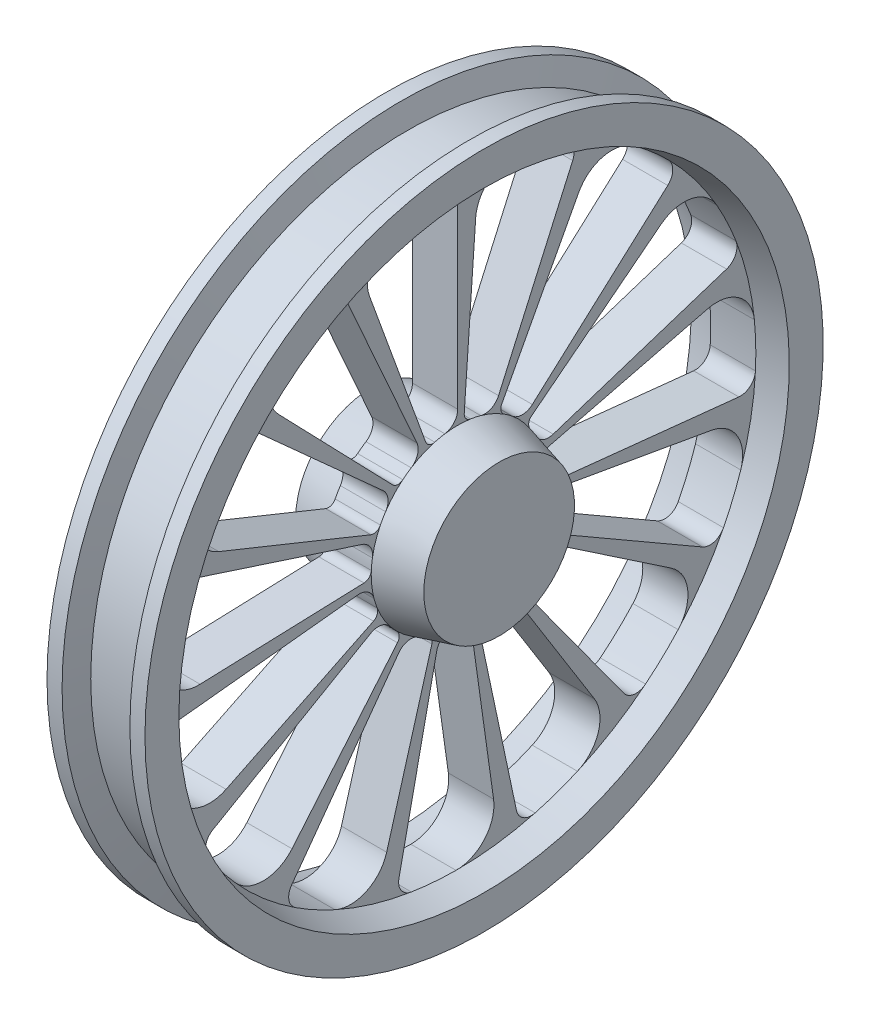
from build123d import *

# Parameters (mm, degrees)
ENL_V_MAT_EXTRU_1_DEPTH = 647.703177663


with BuildPart() as part:
    # Esquisse2 → Révolution1 (revolve)
    with BuildSketch(Plane.XY, mode=Mode.PRIVATE) as r_volution1_sk:
        Polygon((-85, 0), (-85, 100), (-30, 114.737205584), (-30, 395.621778265), (-65, 405), (-65, 450), (-45, 450), (-36.961524227, 420), (36.961524227, 420), (45, 450), (65, 450), (65, 405), (30, 395.621778265), (30, 114.737205584), (85, 100), (85, 0), align=None)
    revolve(r_volution1_sk.sketch.rotate(Axis((-85, 0, 0), (1, 0, 0)), 90), axis=Axis((-85, 0, 0), (1, 0, 0)))

    # Esquisse3 → Enlèv. mat.-Extru.1 (cut, through all)
    with BuildSketch(Plane.ZY.offset(30)):
        with BuildLine():
            Line((0, 375.08894986), (0, 133.24456675))
            ThreePointArc((0, 133.24456675), (4.844558076, 120.194180546), (17.031258009, 113.46612973))
            ThreePointArc((17.031258009, 113.46612973), (23.794589812, 112.242789705), (30.472538424, 110.616683855))
            ThreePointArc((30.472538424, 110.616683855), (37.714753572, 111.371314729), (42.525319659, 116.837355519))
            Line((42.525319659, 116.837355519), (116.966095442, 321.36170607))
            ThreePointArc((116.966095442, 321.36170607), (113.645015457, 362.824451872), (80.105459591, 387.427034138))
            ThreePointArc((80.105459591, 387.427034138), (50.728968231, 392.35591396), (21.064900981, 395.060579385))
            ThreePointArc((21.064900981, 395.060579385), (6.239513446, 389.602702297), (0, 375.08894986))
        make_face()
        with BuildLine():
            Line((152.562420321, 342.660806356), (54.195447788, 121.72496871))
            ThreePointArc((54.195447788, 121.72496871), (53.313101537, 107.832388384), (61.709661101, 96.729230701))
            ThreePointArc((61.709661101, 96.729230701), (67.390694934, 92.860759105), (72.82990772, 88.659071091))
            ThreePointArc((72.82990772, 88.659071091), (79.7529365, 86.40278642), (86.370846379, 89.439629654))
            Line((86.370846379, 89.439629654), (237.563426729, 246.004129826))
            ThreePointArc((237.563426729, 246.004129826), (251.393887235, 285.233037841), (230.760750044, 321.350381479))
            ThreePointArc((230.760750044, 321.350381479), (205.928745834, 337.801632733), (179.929358477, 352.337930679))
            ThreePointArc((179.929358477, 352.337930679), (164.165774432, 353.381940215), (152.562420321, 342.660806356))
        make_face()
        with BuildLine():
            Line((278.745412182, 250.983496458), (99.020010304, 89.158017744))
            ThreePointArc((99.020010304, 89.158017744), (92.563325408, 76.825396644), (95.717903174, 63.266968927))
            ThreePointArc((95.717903174, 63.266968927), (99.334336676, 57.422259641), (102.594324332, 51.371499492))
            ThreePointArc((102.594324332, 51.371499492), (108.001112174, 46.494431395), (115.282069106, 46.576979287))
            Line((115.282069106, 46.576979287), (317.083883339, 128.110204659))
            ThreePointArc((317.083883339, 128.110204659), (345.674472068, 158.322240305), (341.515410419, 199.709328485))
            ThreePointArc((341.515410419, 199.709328485), (325.521572478, 224.838380374), (307.682395286, 248.69285287))
            ThreePointArc((307.682395286, 248.69285287), (293.70628162, 256.058230296), (278.745412182, 250.983496458))
        make_face()
        with BuildLine():
            Line((356.730789954, 115.908859909), (126.723113469, 41.174835534))
            ThreePointArc((126.723113469, 41.174835534), (115.808509405, 32.534595887), (113.175650218, 18.865273462))
            ThreePointArc((113.175650218, 18.865273462), (114.102169183, 12.054929821), (114.619250226, 5.201328936))
            ThreePointArc((114.619250226, 5.201328936), (117.574914394, -1.453233208), (124.259974779, -4.339253936))
            Line((124.259974779, -4.339253936), (341.777655903, -11.935138739))
            ThreePointArc((341.777655903, -11.935138739), (380.184800327, 4.036089109), (393.218953762, 43.536718294))
            ThreePointArc((393.218953762, 43.536718294), (388.82876197, 72.998529456), (382.234350743, 102.046521495))
            ThreePointArc((382.234350743, 102.046521495), (372.462304477, 114.459726143), (356.730789954, 115.908859909))
        make_face()
        with BuildLine():
            Line((373.034173346, -39.207471518), (132.514639072, -13.927849801))
            ThreePointArc((132.514639072, -13.927849801), (119.029350038, -17.381732066), (111.064299172, -28.798399169))
            ThreePointArc((111.064299172, -28.798399169), (109.140700052, -35.39680688), (106.825466474, -41.868198646))
            ThreePointArc((106.825466474, -41.868198646), (106.818945781, -49.149620586), (111.752201947, -54.505190733))
            Line((111.752201947, -54.505190733), (307.374966808, -149.916788222))
            ThreePointArc((307.374966808, -149.916788222), (348.957722738, -150.947938561), (376.931367718, -120.163786009))
            ThreePointArc((376.931367718, -120.163786009), (384.903926118, -91.463430376), (390.694514467, -62.24458051))
            ThreePointArc((390.694514467, -62.24458051), (386.816211177, -46.929904495), (373.034173346, -39.207471518))
        make_face()
        with BuildLine():
            Line((324.836559257, -187.54447493), (115.393179722, -66.622283375))
            ThreePointArc((115.393179722, -66.622283375), (101.668934702, -64.292600637), (89.74892181, -71.482566959))
            ThreePointArc((89.74892181, -71.482566959), (85.30781237, -76.728114103), (80.560589089, -81.698334321))
            ThreePointArc((80.560589089, -81.698334321), (77.593011023, -88.347592055), (79.921458161, -95.246684889))
            Line((79.921458161, -95.246684889), (219.824353539, -261.976463069))
            ThreePointArc((219.824353539, -261.976463069), (257.392684707, -279.831696335), (295.468923881, -263.086880057))
            ThreePointArc((295.468923881, -263.086880057), (314.425704699, -240.110532176), (331.600047291, -215.77302907))
            ThreePointArc((331.600047291, -215.77302907), (334.286080849, -200.2049283), (324.836559257, -187.54447493))
        make_face()
        with BuildLine():
            Line((220.471753025, -303.453334839), (78.319191284, -107.797118909))
            ThreePointArc((78.319191284, -107.797118909), (66.729036923, -100.086694478), (52.915140525, -101.806749523))
            ThreePointArc((52.915140525, -101.806749523), (46.724428933, -104.792433344), (40.366053981, -107.402085786))
            ThreePointArc((40.366053981, -107.402085786), (34.950539748, -112.269462245), (34.271568195, -119.519161938))
            Line((34.271568195, -119.519161938), (94.264112501, -328.738027471))
            ThreePointArc((94.264112501, -328.738027471), (121.322113151, -360.330011621), (162.917218854, -360.519862474))
            ThreePointArc((162.917218854, -360.519862474), (189.580422469, -347.240341628), (215.168919447, -331.992360668))
            ThreePointArc((215.168919447, -331.992360668), (223.954850249, -318.862701198), (220.471753025, -303.453334839))
        make_face()
        with BuildLine():
            Line((77.985377772, -366.892356367), (27.703103165, -130.332853278))
            ThreePointArc((27.703103165, -130.332853278), (20.251082445, -118.574889584), (6.931850724, -114.527620209))
            ThreePointArc((6.931850724, -114.527620209), (0.061967254, -114.73718885), (-6.808138575, -114.535040901))
            ThreePointArc((-6.808138575, -114.535040901), (-13.735197365, -116.778922477), (-17.304187259, -123.12569009))
            Line((-17.304187259, -123.12569009), (-47.595249951, -338.657800431))
            ThreePointArc((-47.595249951, -338.657800431), (-35.726153945, -378.523994403), (2.195646631, -395.615685449))
            ThreePointArc((2.195646631, -395.615685449), (31.954962911, -394.329141432), (61.533130682, -390.80719705))
            ThreePointArc((61.533130682, -390.80719705), (74.899791474, -382.386216282), (77.985377772, -366.892356367))
        make_face()
        with BuildLine():
            Line((-77.985377772, -366.892356367), (-27.703103165, -130.332853278))
            ThreePointArc((-27.703103165, -130.332853278), (-29.728468162, -116.560409062), (-40.250019041, -107.44562491))
            ThreePointArc((-40.250019041, -107.44562491), (-46.611209125, -104.84284205), (-52.805142121, -101.863846927))
            ThreePointArc((-52.805142121, -101.863846927), (-60.045994073, -101.096246109), (-65.887891532, -105.442667864))
            Line((-65.887891532, -105.442667864), (-181.224961297, -290.020563088))
            ThreePointArc((-181.224961297, -290.020563088), (-186.597044463, -331.26773977), (-158.905572841, -362.305962354))
            ThreePointArc((-158.905572841, -362.305962354), (-131.195800037, -373.234850316), (-102.742295389, -382.04791869))
            ThreePointArc((-102.742295389, -382.04791869), (-87.106121689, -379.791680701), (-77.985377772, -366.892356367))
        make_face()
        with BuildLine():
            Line((-220.471753025, -303.453334839), (-78.319191284, -107.797118909))
            ThreePointArc((-78.319191284, -107.797118909), (-74.56769655, -94.391574896), (-80.472294854, -81.785304952))
            ThreePointArc((-80.472294854, -81.785304952), (-85.224883997, -76.820215392), (-89.671656875, -71.579468415))
            ThreePointArc((-89.671656875, -71.579468415), (-95.974292905, -67.933110359), (-103.078980787, -69.527650448))
            Line((-103.078980787, -69.527650448), (-283.519230458, -191.236135632))
            ThreePointArc((-283.519230458, -191.236135632), (-305.203610812, -226.732283458), (-292.530575158, -266.350246922))
            ThreePointArc((-292.530575158, -266.350246922), (-271.661617282, -287.604862847), (-249.252645203, -307.229084393))
            ThreePointArc((-249.252645203, -307.229084393), (-234.050595078, -311.527713227), (-220.471753025, -303.453334839))
        make_face()
        with BuildLine():
            Line((-324.836559257, -187.54447493), (-115.393179722, -66.622283375))
            ThreePointArc((-115.393179722, -66.622283375), (-106.513492778, -55.901579909), (-106.780179819, -41.983562771))
            ThreePointArc((-106.780179819, -41.983562771), (-109.102402183, -35.514675603), (-111.033127513, -28.918349534))
            ThreePointArc((-111.033127513, -28.918349534), (-115.307764594, -23.023722674), (-122.44677782, -21.590670631))
            Line((-122.44677782, -21.590670631), (-336.790448981, -59.385243))
            ThreePointArc((-336.790448981, -59.385243), (-371.037700164, -82.992755537), (-375.574383472, -124.340154081))
            ThreePointArc((-375.574383472, -124.340154081), (-365.15467293, -152.245381784), (-352.664948272, -179.287550315))
            ThreePointArc((-352.664948272, -179.287550315), (-340.525594295, -189.397773997), (-324.836559257, -187.54447493))
        make_face()
        with BuildLine():
            Line((-373.034173346, -39.207471518), (-132.514639072, -13.927849801))
            ThreePointArc((-132.514639072, -13.927849801), (-120.04213846, -7.745693906), (-114.624801626, 5.077518822))
            ThreePointArc((-114.624801626, 5.077518822), (-114.115123866, 11.931674239), (-113.1959617, 18.743014695))
            ThreePointArc((-113.1959617, 18.743014695), (-114.703476248, 25.866675825), (-120.642414575, 30.079532284))
            Line((-120.642414575, 30.079532284), (-331.82753923, 82.733897645))
            ThreePointArc((-331.82753923, 82.733897645), (-372.716000386, 75.096973781), (-393.677968898, 39.169480995))
            ThreePointArc((-393.677968898, 39.169480995), (-395.509168303, 9.438708895), (-395.098277924, -20.345570012))
            ThreePointArc((-395.098277924, -20.345570012), (-388.120624681, -34.519239017), (-373.034173346, -39.207471518))
        make_face()
        with BuildLine():
            Line((-356.730789954, 115.908859909), (-126.723113469, 41.174835534))
            ThreePointArc((-126.723113469, 41.174835534), (-112.814407853, 41.74949294), (-102.649753898, 51.260651282))
            ThreePointArc((-102.649753898, 51.260651282), (-99.39630393, 57.314929209), (-95.786185757, 63.163541409))
            ThreePointArc((-95.786185757, 63.163541409), (-94.265914809, 70.284491082), (-97.977881847, 76.548710803))
            Line((-97.977881847, 76.548710803), (-269.488633388, 210.547595773))
            ThreePointArc((-269.488633388, 210.547595773), (-309.948318122, 220.201754098), (-343.71105705, 195.906356964))
            ThreePointArc((-343.71105705, 195.906356964), (-357.476535388, 169.490761059), (-369.215525968, 142.11434418))
            ThreePointArc((-369.215525968, 142.11434418), (-368.606073094, 126.327985986), (-356.730789954, 115.908859909))
        make_face()
        with BuildLine():
            Line((-278.745412182, 250.983496458), (-99.020010304, 89.158017744))
            ThreePointArc((-99.020010304, 89.158017744), (-86.080041242, 84.025813175), (-72.925631177, 88.580351448))
            ThreePointArc((-72.925631177, 88.580351448), (-67.490960057, 92.787912228), (-61.814108105, 96.662517991))
            ThreePointArc((-61.814108105, 96.662517991), (-57.528920322, 102.549479317), (-58.372083247, 109.7819218))
            Line((-58.372083247, 109.7819218), (-160.552694605, 301.955701827))
            ThreePointArc((-160.552694605, 301.955701827), (-193.587755864, 327.231650661), (-234.313380921, 318.769244061))
            ThreePointArc((-234.313380921, 318.769244061), (-257.632961932, 300.23632086), (-279.492055354, 280.001397195))
            ThreePointArc((-279.492055354, 280.001397195), (-285.356182788, 265.331954558), (-278.745412182, 250.983496458))
        make_face()
        with BuildLine():
            Line((-152.562420321, 342.660806356), (-54.195447788, 121.72496871))
            ThreePointArc((-54.195447788, 121.72496871), (-44.461653488, 111.773306962), (-30.592004317, 110.583704121))
            ThreePointArc((-30.592004317, 110.583704121), (-23.915816055, 112.217022272), (-17.153809599, 113.44766706))
            ThreePointArc((-17.153809599, 113.44766706), (-10.844652876, 117.082730945), (-8.67322116, 124.032841181))
            Line((-8.67322116, 124.032841181), (-23.85573635, 341.152923854))
            ThreePointArc((-23.85573635, 341.152923854), (-43.754111926, 377.680222019), (-84.40079256, 386.514032931))
            ThreePointArc((-84.40079256, 386.514032931), (-113.242308836, 379.068293223), (-141.441869264, 369.473664903))
            ThreePointArc((-141.441869264, 369.473664903), (-152.765616099, 358.457617722), (-152.562420321, 342.660806356))
        make_face()
    extrude(amount=-ENL_V_MAT_EXTRU_1_DEPTH, mode=Mode.SUBTRACT)


solid = part.part
